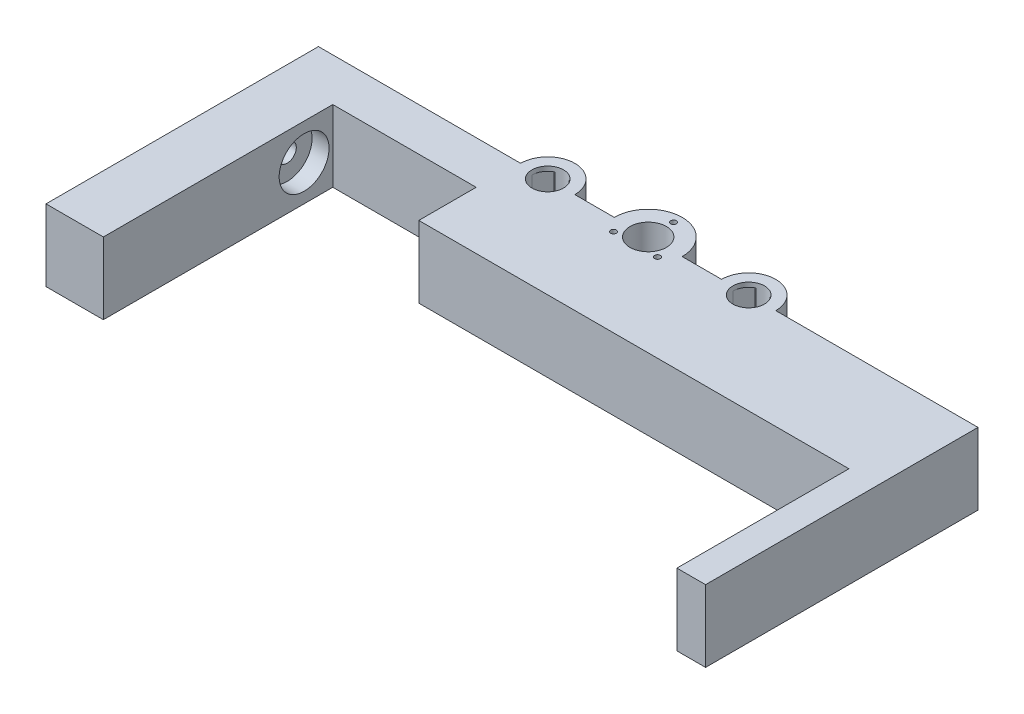
from build123d import *

# Parameters (mm, degrees)
SKETCH1_R           = 8.05
SKETCH1_R_2         = 7
SKETCH1_R_3         = 1.25
BOSS_EXTRUDE1_DEPTH = 15.875
SKETCH2_R           = 11.05
CUT_EXTRUDE1_DEPTH  = 7.5
CUT_EXTRUDE3_START  = -7.5
SKETCH3_R           = 11.05
CUT_EXTRUDE3_DEPTH  = 7.5
SKETCH4_R           = 4.05
CUT_EXTRUDE4_DEPTH  = 10.4
SKETCH5_W           = 4
SKETCH5_H           = 27.75
CUT_EXTRUDE5_DEPTH  = 191.102710725


with BuildPart() as part:
    # Sketch1 → Boss-Extrude1 (new, symmetric)
    with BuildSketch(Plane(origin=(0, 0, 0), x_dir=(1, 0, 0), z_dir=(0, 1, 0))):
        with BuildLine():
            Line((-146.05, 0), (-56.5, 0))
            ThreePointArc((-56.5, 0), (-44.5, 12), (-32.5, 0))
            Line((-32.5, 0), (-15.05, 0))
            ThreePointArc((-15.05, 0), (0, 15.05), (15.05, 0))
            Line((15.05, 0), (32.5, 0))
            ThreePointArc((32.5, 0), (44.5, 12), (56.5, 0))
            Line((56.5, 0), (146.05, 0))
            Line((146.05, 0), (146.05, -120.65))
            Line((146.05, -120.65), (133.35, -120.65))
            Line((133.35, -120.65), (133.35, -44.45))
            Line((133.35, -44.45), (-57.15, -44.45))
            Line((-57.15, -44.45), (-57.15, -19.05))
            Line((-57.15, -19.05), (-120.65, -19.05))
            Line((-120.65, -19.05), (-120.65, -120.65))
            Line((-120.65, -120.65), (-146.05, -120.65))
            Line((-146.05, -120.65), (-146.05, 0))
        make_face()
        with Locations(Location((0, 0, 0), (0, 0, 270))):
            Circle(SKETCH1_R, mode=Mode.SUBTRACT)
        with Locations(Location((-44.5, 0, 0), (0, 0, 270))):
            Circle(SKETCH1_R_2, mode=Mode.SUBTRACT)
        with Locations(Location((44.5, 0, 0), (0, 0, 270))):
            Circle(SKETCH1_R_2, mode=Mode.SUBTRACT)
        with Locations(Location((0, 11.25, 0), (0, 0, 270))):
            Circle(SKETCH1_R_3, mode=Mode.SUBTRACT)
        with Locations(Location((9.742785793, -5.625, 0), (0, 0, 270))):
            Circle(SKETCH1_R_3, mode=Mode.SUBTRACT)
        with Locations(Location((-9.742785793, -5.625, 0), (0, 0, 270))):
            Circle(SKETCH1_R_3, mode=Mode.SUBTRACT)
    extrude(amount=BOSS_EXTRUDE1_DEPTH, both=True)

    # Sketch2 → Cut-Extrude1 (cut)
    with BuildSketch(Plane.ZY.offset(146.05)):
        with Locations((31.75, 0)):
            Circle(SKETCH2_R)
    extrude(amount=-CUT_EXTRUDE1_DEPTH, mode=Mode.SUBTRACT)

    # Sketch3 → Cut-Extrude3 (cut)
    with BuildSketch(Plane(origin=(-120.65, 0, 0), x_dir=(0, 0, -1), z_dir=(1, 0, 0)).offset(CUT_EXTRUDE3_START)):
        with Locations(Location((-31.75, 0, 0), (0, 0, 180))):
            Circle(SKETCH3_R)
    extrude(amount=CUT_EXTRUDE3_DEPTH, mode=Mode.SUBTRACT)

    # Sketch4 → Cut-Extrude4 (cut)
    with BuildSketch(Plane.ZY.offset(138.55)):
        with Locations((31.75, 0)):
            Circle(SKETCH4_R)
    extrude(amount=-CUT_EXTRUDE4_DEPTH, mode=Mode.SUBTRACT)

    # Sketch5 → Cut-Extrude5 (cut, through all)
    with BuildSketch(Plane(origin=(0, 0, 0), x_dir=(-1, 0, 0), z_dir=(0, 0, -1))):
        with Locations((-49.5, 0)):
            Rectangle(SKETCH5_W, SKETCH5_H)
        with Locations((-39.5, 0)):
            Rectangle(SKETCH5_W, SKETCH5_H)
        with Locations((49.5, 0)):
            Rectangle(SKETCH5_W, SKETCH5_H)
        with Locations((39.5, 0)):
            Rectangle(SKETCH5_W, SKETCH5_H)
    extrude(amount=CUT_EXTRUDE5_DEPTH, mode=Mode.SUBTRACT)


solid = part.part
